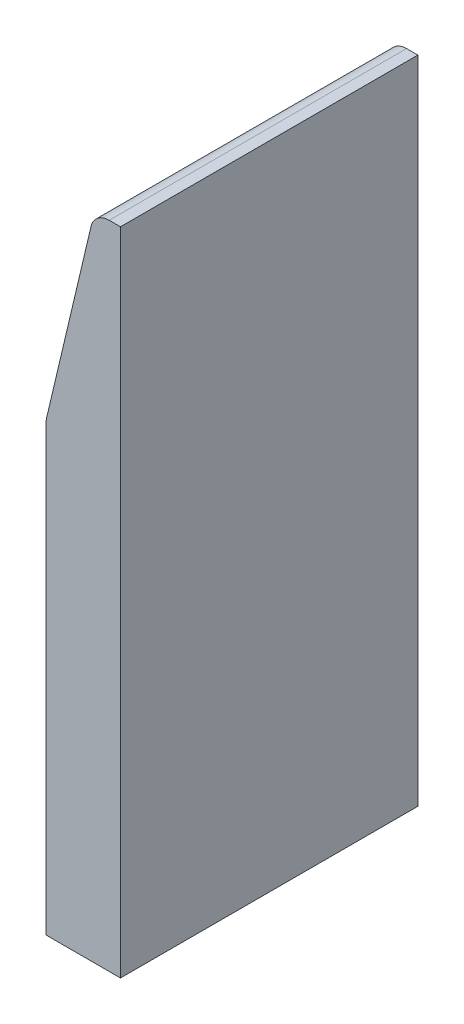
from build123d import *

# Parameters (mm, degrees)
EXTRUDE_1_DEPTH = 40
CHAMFER_1_SIZE  = 5
FILLET_1_R      = 5


with BuildPart() as part:
    # 草图1 → 凸台-拉伸1 (new, symmetric)
    with BuildSketch(Plane.XY):
        Polygon((0, 0), (0, 125), (13, 180), (20, 180), (20, 0), align=None)
    extrude(amount=EXTRUDE_1_DEPTH, both=True)

    # 倒角1
    chamfer_1_edges = [part.edges().sort_by_distance(p)[0] for p in [
        (10, 0, 40),
        (10, 0, -40),
        (0, 0, 0),
        (20, 0, 0),
    ]]
    chamfer(chamfer_1_edges, length=CHAMFER_1_SIZE)

    # 圆角1
    fillet_1_edges = [part.edges().sort_by_distance(p)[0] for p in [
        (0, 125, 0),
        (13, 180, 0),
    ]]
    fillet(fillet_1_edges, radius=FILLET_1_R)


solid = part.part
